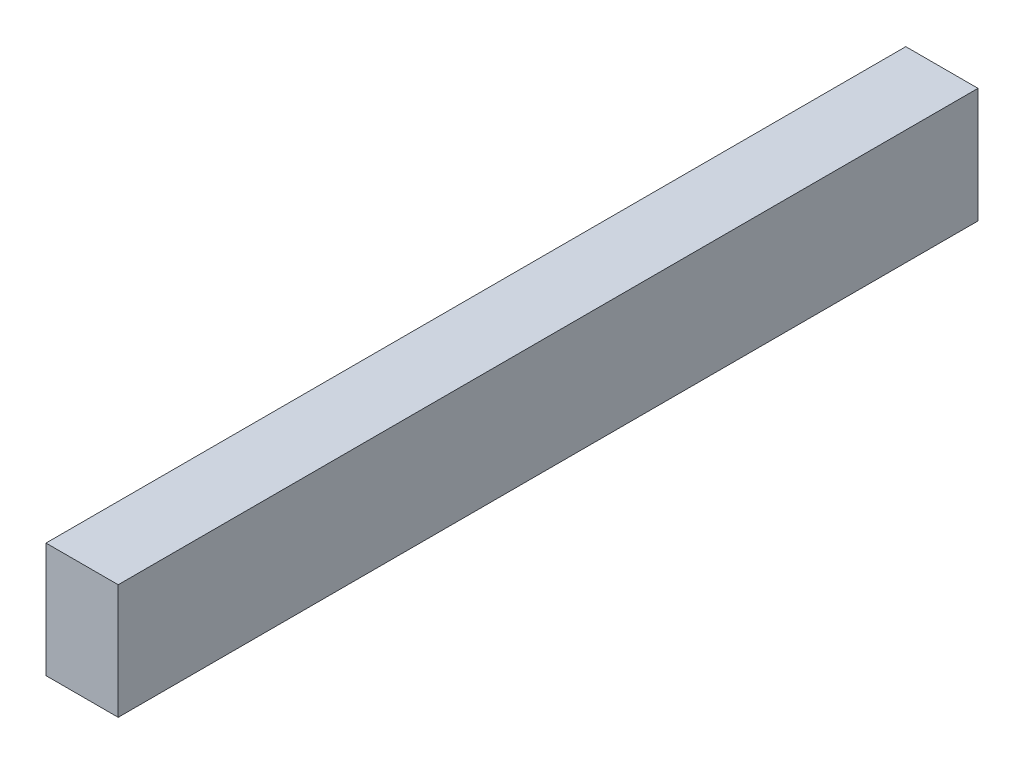
from build123d import *

# Parameters (mm, degrees)
SKETCH2_W           = 4.4
SKETCH2_H           = 7
BOSS_EXTRUDE1_DEPTH = 52.4


with BuildPart() as part:
    # Sketch2 → Boss-Extrude1 (new body)
    with BuildSketch(Plane.XY):
        with Locations((-27.3625, 7.00625)):
            Rectangle(SKETCH2_W, SKETCH2_H)
    extrude(amount=BOSS_EXTRUDE1_DEPTH)


solid = part.part
